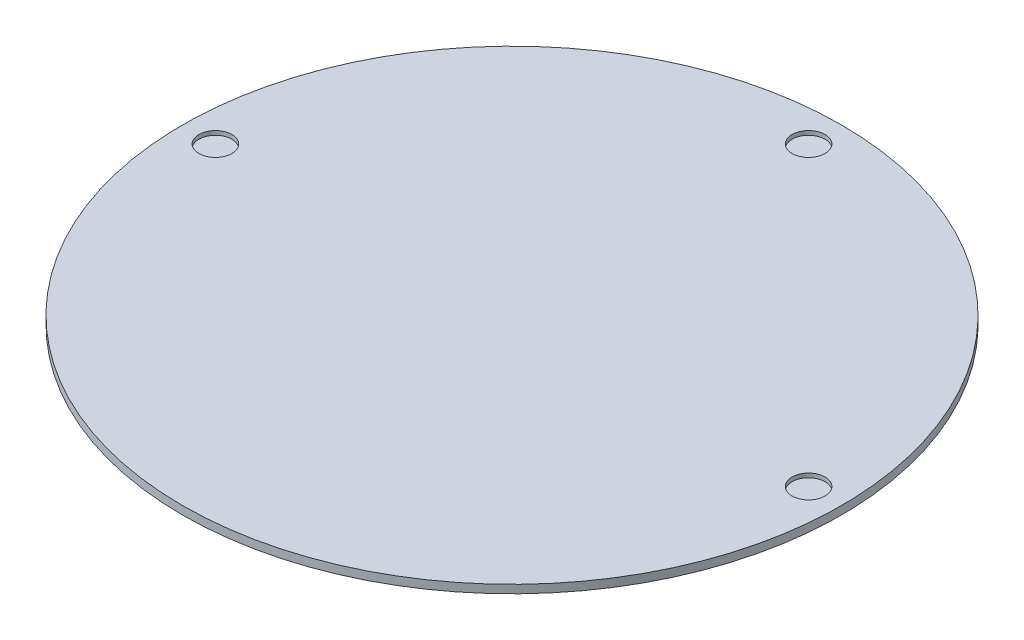
from build123d import *

# Parameters (mm, degrees)
SKETCH1_R           = 400
BOSS_EXTRUDE1_DEPTH = 10
SKETCH2_R           = 20
CUT_EXTRUDE2_DEPTH  = 5


with BuildPart() as part:
    # Sketch1 → Boss-Extrude1 (new body)
    with BuildSketch(Plane(origin=(0, 0, 0), x_dir=(1, 0, 0), z_dir=(0, 1, 0))):
        with Locations(Location((0, 0, 0), (0, 0, 270))):
            Circle(SKETCH1_R)
    extrude(amount=BOSS_EXTRUDE1_DEPTH)

    # Sketch2 → Cut-Extrude2 (cut)
    with BuildSketch(Plane(origin=(0, 10, 0), x_dir=(1, 0, 0), z_dir=(0, 1, 0))):
        with Locations(Location((360, 0, 0), (0, 0, 270))):
            Circle(SKETCH2_R)
        with Locations(Location((-360, 0, 0), (0, 0, 270))):
            Circle(SKETCH2_R)
        with Locations(Location((0, 360, 0), (0, 0, 270))):
            Circle(SKETCH2_R)
    extrude(amount=-CUT_EXTRUDE2_DEPTH, mode=Mode.SUBTRACT)


solid = part.part
